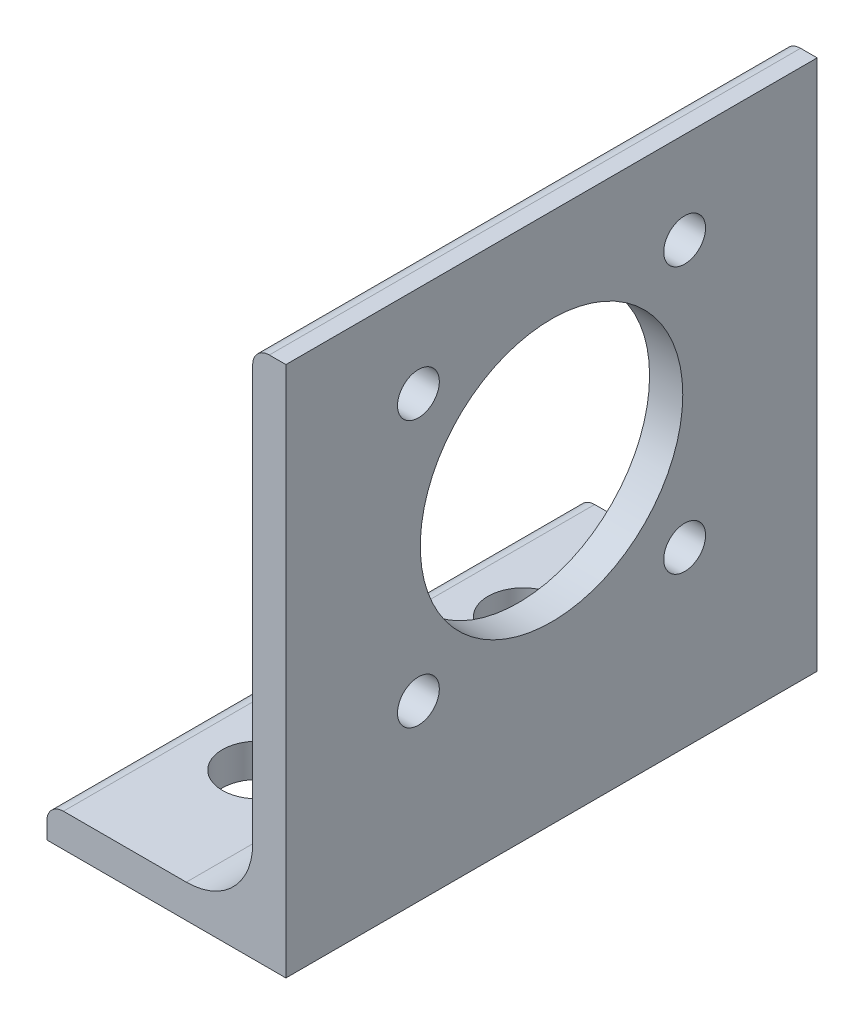
from build123d import *

# Parameters (mm, degrees)
BOSS_EXTRUDE1_DEPTH = 25.4
SKETCH3_W           = 27.94
SKETCH3_H           = 13.830872484
CUT_EXTRUDE1_DEPTH  = 77.2
FILLET1_R           = 1.5875
SKETCH4_R           = 3.3782
CUT_EXTRUDE2_DEPTH  = 60.652834174
SKETCH5_R           = 2.000000064
SKETCH5_R_2         = 12.55
CUT_EXTRUDE3_DEPTH  = 62.224011629


with BuildPart() as part:
    # Sketch2 → Boss-Extrude1 (new, symmetric)
    with BuildSketch(Plane.XY):
        with BuildLine():
            Line((-25.4, 0), (25.4, 0))
            Line((25.4, 0), (25.4, 50.8))
            Line((25.4, 50.8), (23.8125, 50.8))
            ThreePointArc((23.8125, 50.8), (22.689967985, 50.335032015), (22.225, 49.2125))
            Line((22.225, 49.2125), (22.225, 9.525))
            ThreePointArc((22.225, 9.525), (20.365128061, 5.034871939), (15.875, 3.175))
            Line((15.875, 3.175), (-23.8125, 3.175))
            ThreePointArc((-23.8125, 3.175), (-24.935032015, 2.710032015), (-25.4, 1.5875))
            Line((-25.4, 1.5875), (-25.4, 0))
        make_face()
    extrude(amount=BOSS_EXTRUDE1_DEPTH, both=True)

    # Sketch3 → Cut-Extrude1 (cut, through all)
    with BuildSketch(Plane(origin=(0, 0, -25.4), x_dir=(-1, 0, 0), z_dir=(0, 0, -1))):
        with Locations((11.43, 1.484116331)):
            Rectangle(SKETCH3_W, SKETCH3_H)
    extrude(amount=-CUT_EXTRUDE1_DEPTH, mode=Mode.SUBTRACT)

    # Fillet1
    fillet1_edges = [part.edges().sort_by_distance(p)[0] for p in [
        (2.54, 3.175, 0),
    ]]
    fillet(fillet1_edges, radius=FILLET1_R)

    # Sketch4 → Cut-Extrude2 (cut, through all)
    with BuildSketch(Plane(origin=(0, 3.175, 0), x_dir=(1, 0, 0), z_dir=(0, 1, 0))):
        with Locations(Location((10.00125, 12.7, 0), (0, 0, 180))):
            Circle(SKETCH4_R)
        with Locations(Location((10.00125, -12.7, 0), (0, 0, 180))):
            Circle(SKETCH4_R)
    extrude(amount=-CUT_EXTRUDE2_DEPTH, mode=Mode.SUBTRACT)

    # Sketch5 → Cut-Extrude3 (cut, through all)
    with BuildSketch(Plane(origin=(25.4, 0, 0), x_dir=(0, 0, -1), z_dir=(1, 0, 0))):
        with Locations((12.72792202, 16.6)):
            Circle(SKETCH5_R)
        with Locations((-12.72792202, 16.6)):
            Circle(SKETCH5_R)
        with Locations((-12.72792202, 42.055844039)):
            Circle(SKETCH5_R)
        with Locations((12.72792202, 42.055844039)):
            Circle(SKETCH5_R)
        with Locations((0, 29.32792202)):
            Circle(SKETCH5_R_2)
    extrude(amount=-CUT_EXTRUDE3_DEPTH, mode=Mode.SUBTRACT)


solid = part.part
